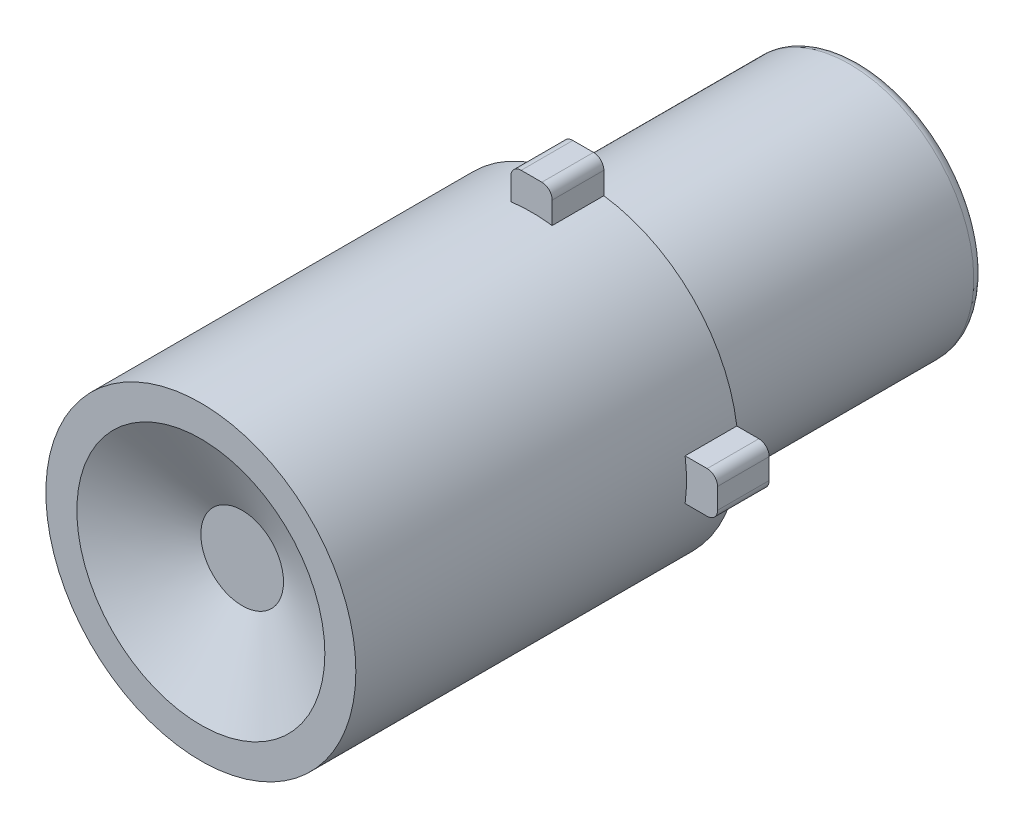
from build123d import *

# Parameters (mm, degrees)
SKETCH1_R               = 3.75
BOSS_EXTRUDE1_DEPTH     = 10
SKETCH4_W               = 1
SKETCH4_H               = 1
BOSS_EXTRUDE2_DEPTH     = 2
CUT_EXTRUDE1_DEPTH      = 6.5
CUT_EXTRUDE1_DEPTH_BACK = 6.5
SKETCH5_W               = 3.094482754
SKETCH5_H               = 13.244386188
SKETCH6_R               = 3
BOSS_EXTRUDE3_DEPTH     = 6.7
SKETCH7_R               = 2.5
CUT_EXTRUDE2_DEPTH      = 1.25
FILLET2_R               = 0.25
FILLET3_R               = 0.25


with BuildPart() as part:
    # Sketch1 → Boss-Extrude1 (new body)
    with BuildSketch(Plane.XY):
        Circle(SKETCH1_R)
    extrude(amount=BOSS_EXTRUDE1_DEPTH)

    # Sketch3 → Cut-Revolve1 (revolve, cut)
    with BuildSketch(Plane(origin=(0, 0, 0), x_dir=(1, 0, 0), z_dir=(0, 1, 0)), mode=Mode.PRIVATE) as cut_revolve1_sk:
        Polygon((-3, -10), (0, -10), (0, -9), (-1, -9), align=None)
    revolve(cut_revolve1_sk.sketch.rotate(Axis((0, 0, 10), (0, 0, -1)), 180), axis=Axis((0, 0, 10), (0, 0, -1)), mode=Mode.SUBTRACT)

    # Sketch4 → Boss-Extrude2 (add)
    with BuildSketch(Plane(origin=(0, 0, 0), x_dir=(-1, 0, 0), z_dir=(0, 0, -1))):
        with Locations((0, 4)):
            Rectangle(SKETCH4_W, SKETCH4_H)
        with Locations((-4, 0)):
            Rectangle(SKETCH4_W, SKETCH4_H)
        with Locations((4, 0)):
            Rectangle(SKETCH4_W, SKETCH4_H)
        with Locations((0, -4)):
            Rectangle(SKETCH4_W, SKETCH4_H)
    extrude(amount=-BOSS_EXTRUDE2_DEPTH)

    # Sketch5 → Cut-Extrude1 (cut, two sides: drawn at the far end of the back side and taken through both)
    with BuildSketch(Plane(origin=(0, 0, 0), x_dir=(0, 0, -1), z_dir=(1, 0, 0)).offset(-CUT_EXTRUDE1_DEPTH_BACK)):
        with Locations((0.797241377, 0.144409195)):
            Rectangle(SKETCH5_W, SKETCH5_H)
    extrude(amount=CUT_EXTRUDE1_DEPTH + CUT_EXTRUDE1_DEPTH_BACK, mode=Mode.SUBTRACT)

    # Sketch6 → Boss-Extrude3 (add)
    with BuildSketch(Plane(origin=(0, 0, 0.75), x_dir=(-1, 0, 0), z_dir=(0, 0, -1))):
        with Locations(Location((0, 0, 0), (0, 0, 90))):
            Circle(SKETCH6_R)
    extrude(amount=BOSS_EXTRUDE3_DEPTH)

    # Sketch7 → Cut-Extrude2 (cut)
    with BuildSketch(Plane(origin=(0, 0, -5.95), x_dir=(-1, 0, 0), z_dir=(0, 0, -1))):
        with Locations(Location((0, 0, 0), (0, 0, 90))):
            Circle(SKETCH7_R)
    extrude(amount=-CUT_EXTRUDE2_DEPTH, mode=Mode.SUBTRACT)

    # Fillet2
    fillet2_edges = [part.edges().sort_by_distance(p)[0] for p in [
        (0, -3, -5.95),
    ]]
    fillet(fillet2_edges, radius=FILLET2_R)

    # Fillet3
    fillet3_edges = [part.edges().sort_by_distance(p)[0] for p in [
        (4.5, 0.5, 1.375),
        (4.5, -0.5, 1.375),
        (-0.5, 4.5, 1.375),
        (0.5, 4.5, 1.375),
        (-4.5, -0.5, 1.375),
        (-4.5, 0.5, 1.375),
        (0.5, -4.5, 1.375),
        (-0.5, -4.5, 1.375),
    ]]
    fillet(fillet3_edges, radius=FILLET3_R)


solid = part.part
